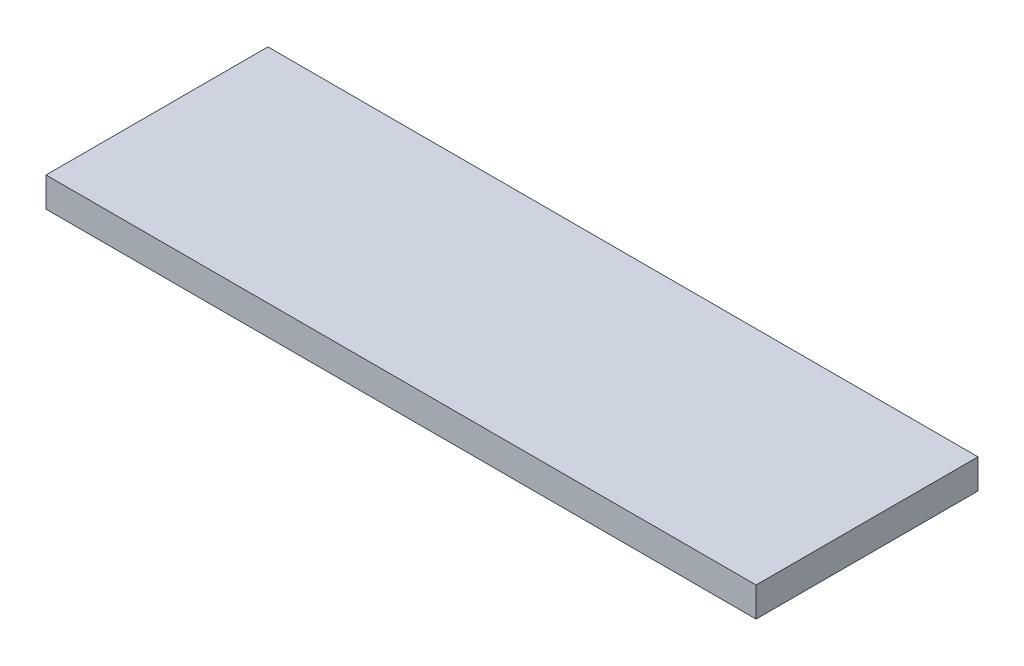
from build123d import *

# Parameters (mm, degrees)
SKETCH1_W           = 96
SKETCH1_H           = 30
BOSS_EXTRUDE1_DEPTH = 4


with BuildPart() as part:
    # Sketch1 → Boss-Extrude1 (new body)
    with BuildSketch(Plane(origin=(0, 0, 0), x_dir=(1, 0, 0), z_dir=(0, 1, 0))):
        with Locations((48, -15)):
            Rectangle(SKETCH1_W, SKETCH1_H)
    extrude(amount=BOSS_EXTRUDE1_DEPTH)


solid = part.part
